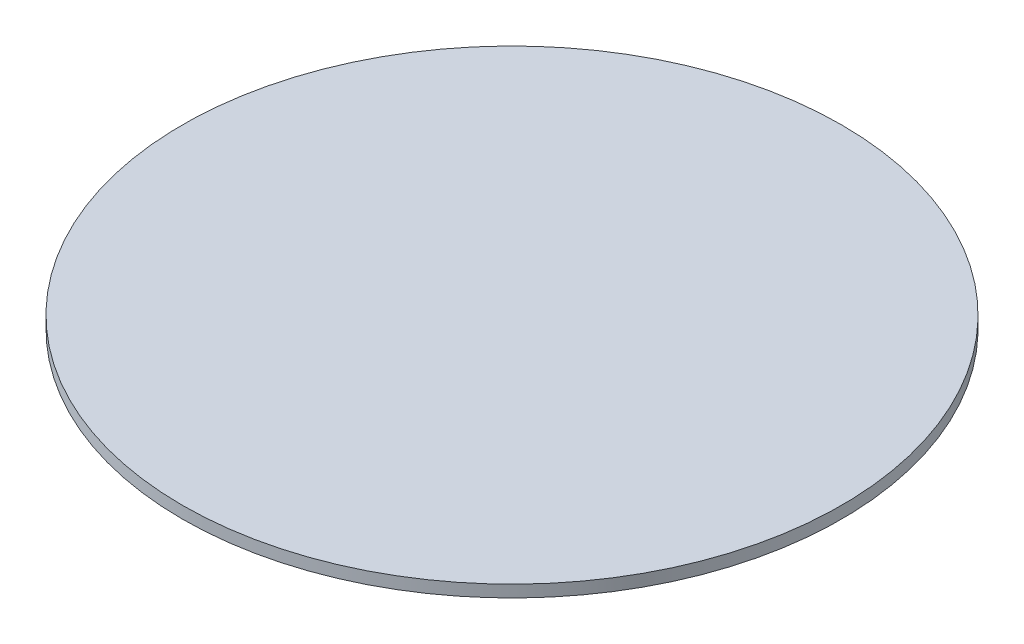
from build123d import *

# Parameters (mm, degrees)
OVEN_TEPSI_NISI_HALKASI_D330_START = 872
SKETCH1_R                          = 165
OVEN_TEPSI_NISI_HALKASI_D330_DEPTH = 6


with BuildPart() as part:
    # Sketch1 → OVEN_tepsi_nisi_halkasi_D330 (new body)
    with BuildSketch(Plane(origin=(0, 0, 0), x_dir=(1, 0, 0), z_dir=(0, 1, 0)).offset(OVEN_TEPSI_NISI_HALKASI_D330_START)):
        with Locations(Location((350, 300, 0), (0, 0, 270))):
            Circle(SKETCH1_R)
    extrude(amount=OVEN_TEPSI_NISI_HALKASI_D330_DEPTH)


solid = part.part
